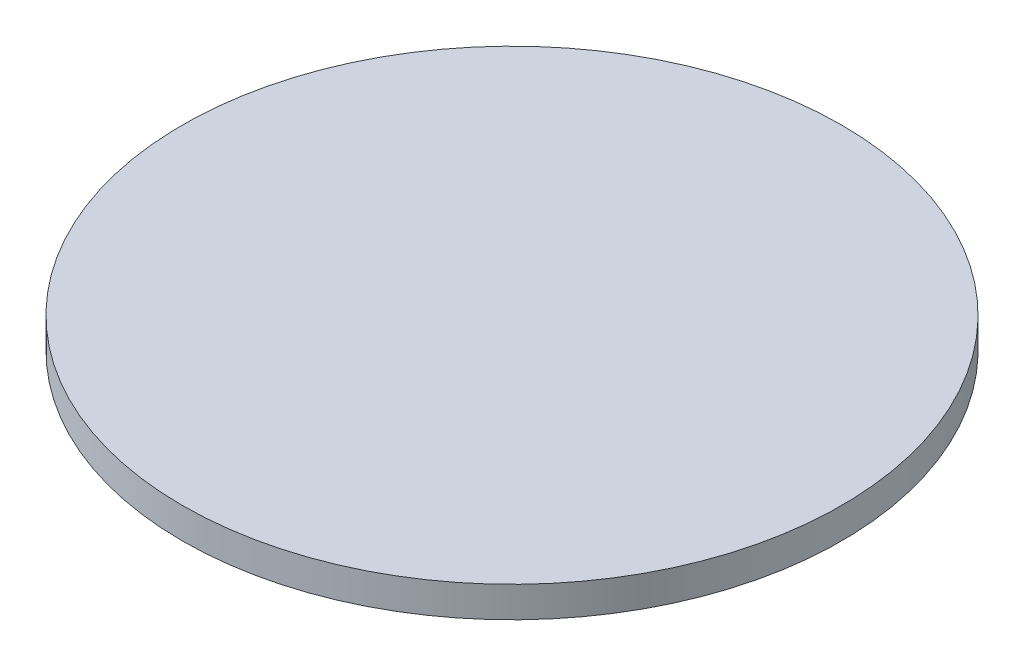
from build123d import *

# Parameters (mm, degrees)
GEL_PAD_SKETCH_R = 16.072988092
GEL_PAD_DEPTH    = 1.5


with BuildPart() as part:
    # Gel Pad Sketch → Gel Pad (new body)
    with BuildSketch(Plane(origin=(0, 0, 97.3), x_dir=(1, 0, 0), z_dir=(0, 1, 0))):
        with Locations(Location((0, 97.3, 0), (0, 0, 270))):
            Circle(GEL_PAD_SKETCH_R)
    extrude(amount=GEL_PAD_DEPTH)


solid = part.part
